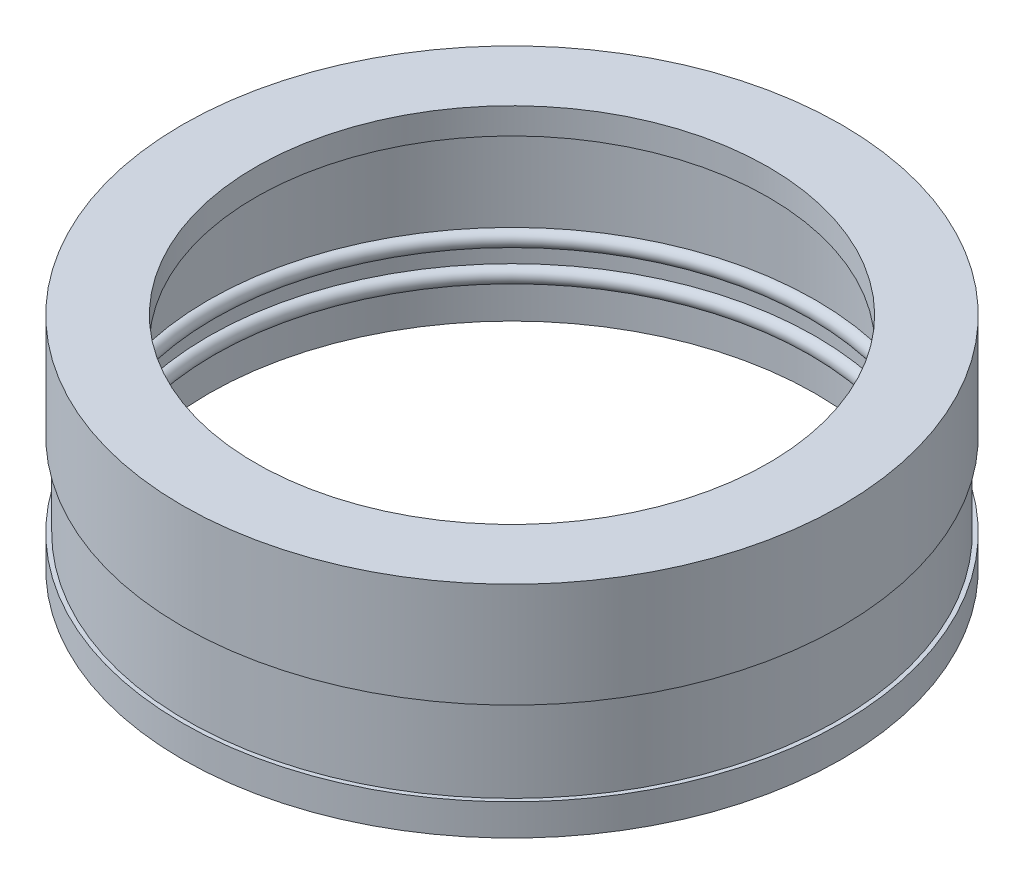
from build123d import *


with BuildPart() as part:
    # Sketch1 → Revolve1 (revolve)
    with BuildSketch(Plane.XY, mode=Mode.PRIVATE) as revolve1_sk:
        with BuildLine():
            Line((49, 42), (63, 42))
            Line((63, 42), (63, 22))
            Line((63, 22), (62.2, 22))
            Line((62.2, 22), (62.2, 6))
            Line((62.2, 6), (63, 6))
            Line((63, 6), (63, 0))
            Line((63, 0), (58, 0))
            Line((58, 0), (58, 6.5))
            ThreePointArc((58, 6.5), (56.5, 8), (58, 9.5))
            Line((58, 9.5), (58, 12.5))
            ThreePointArc((58, 12.5), (56.5, 14), (58, 15.5))
            Line((58, 15.5), (58, 37))
            Line((58, 37), (49, 37))
            Line((49, 37), (49, 42))
        make_face()
    revolve(revolve1_sk.sketch.rotate(Axis((0, 0, 0), (0, 1, 0)), 90), axis=Axis((0, 0, 0), (0, 1, 0)))


solid = part.part
